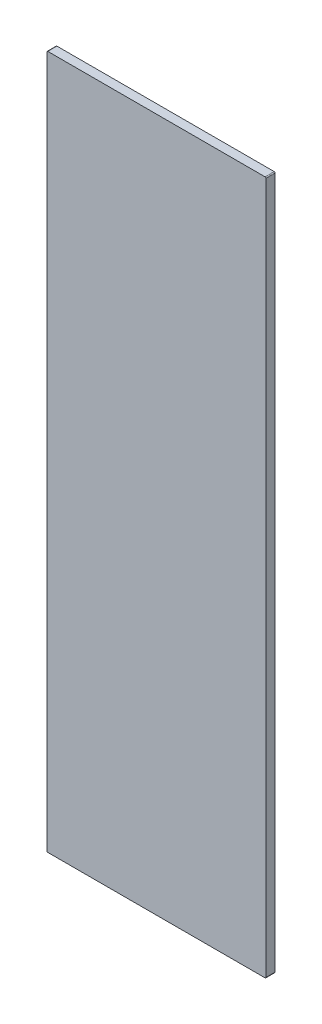
from build123d import *

# Parameters (mm, degrees)
BOSS_EXTRUDE1_DEPTH = 10


with BuildPart() as part:
    # Sketch1 → Boss-Extrude1 (new body)
    with BuildSketch(Plane.XY):
        with BuildLine():
            Line((199, 0), (-39, 0))
            ThreePointArc((-39, 0), (-39.707106781, -0.292893219), (-40, -1))
            Line((-40, -1), (-40, -759))
            ThreePointArc((-40, -759), (-39.707106781, -759.707106781), (-39, -760))
            Line((-39, -760), (199, -760))
            ThreePointArc((199, -760), (199.707106781, -759.707106781), (200, -759))
            Line((200, -759), (200, -1))
            ThreePointArc((200, -1), (199.707106781, -0.292893219), (199, 0))
        make_face()
    extrude(amount=BOSS_EXTRUDE1_DEPTH)


solid = part.part
